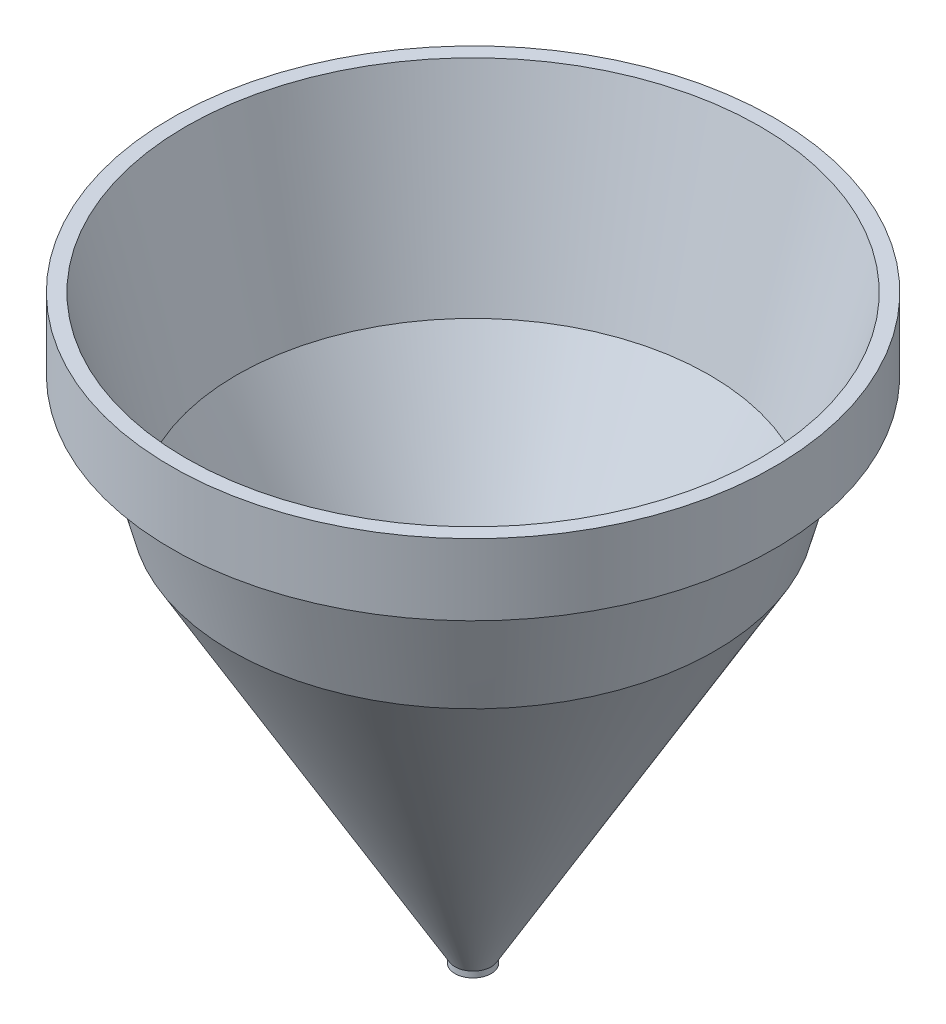
from build123d import *


with BuildPart() as part:
    # Schizzo1 → Rivoluzione1 (revolve)
    with BuildSketch(Plane(origin=(0, 0, 0), x_dir=(0, 0, -1), z_dir=(1, 0, 0))):
        Polygon((-100, 180), (-95, 180), (-81.602540378, 130), (-6.113497125, 0), (-6.113497125, -2), (-4.25, -2), (-4.25, 0), (-79.739043254, 130), (-93.261333513, 180.465874281), (-96.887791569, 194), (-101.8, 194), (-101.8, 170), (-100, 170), align=None)
    revolve(axis=Axis((0, 0, 0), (0, 1, 0)))


solid = part.part
